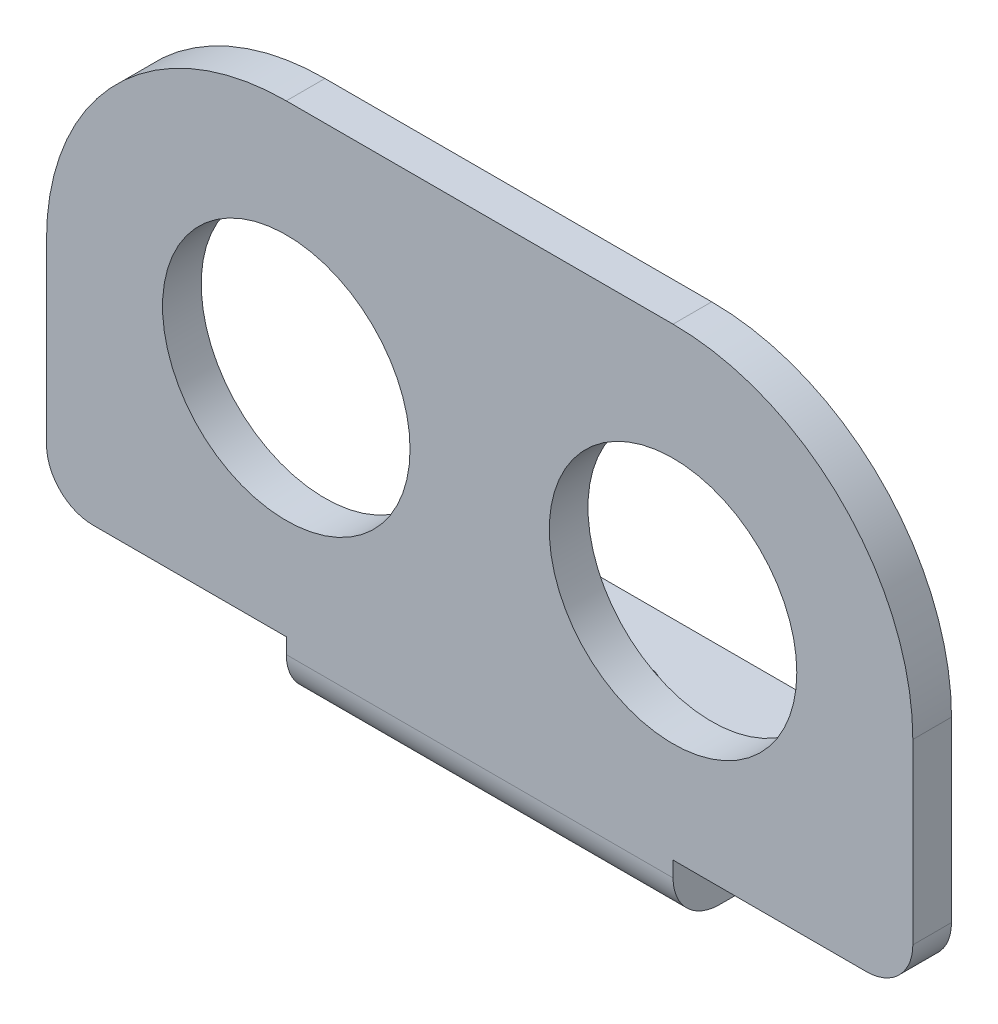
from build123d import *

# Parameters (mm, degrees)
SKETCH1_R           = 8
BOSS_EXTRUDE1_DEPTH = 2.5
FILLET1_R           = 3
SKETCH2_W           = 25
SKETCH2_H           = 3
BOSS_EXTRUDE2_DEPTH = 12
FILLET2_R           = 2.5
FILLET3_R           = 3
SKETCH3_R           = 1.5
CUT_EXTRUDE1_DEPTH  = 44.462627624


with BuildPart() as part:
    # Sketch1 → Boss-Extrude1 (new body)
    with BuildSketch(Plane.XY):
        with BuildLine():
            Line((-28, -15), (-28, -0.5))
            ThreePointArc((-28, -0.5), (-23.460155108, 10.460155108), (-12.5, 15))
            Line((-12.5, 15), (12.5, 15))
            ThreePointArc((12.5, 15), (23.460155108, 10.460155108), (28, -0.5))
            Line((28, -0.5), (28, -15))
            Line((28, -15), (12.5, -15))
            Line((12.5, -15), (12.5, -19))
            Line((12.5, -19), (-12.5, -19))
            Line((-12.5, -19), (-12.5, -15))
            Line((-12.5, -15), (-28, -15))
        make_face()
        with Locations((12.5, -0.5)):
            Circle(SKETCH1_R, mode=Mode.SUBTRACT)
        with Locations((-12.5, -0.5)):
            Circle(SKETCH1_R, mode=Mode.SUBTRACT)
    extrude(amount=BOSS_EXTRUDE1_DEPTH)

    # Fillet1
    fillet1_edges = [part.edges().sort_by_distance(p)[0] for p in [
        (-28, -15, 1.25),
        (28, -15, 1.25),
    ]]
    fillet(fillet1_edges, radius=FILLET1_R)

    # Sketch2 → Boss-Extrude2 (add)
    with BuildSketch(Plane(origin=(0, 0, 0), x_dir=(-1, 0, 0), z_dir=(0, 0, -1))):
        with Locations((0, -17.5)):
            Rectangle(SKETCH2_W, SKETCH2_H)
    extrude(amount=BOSS_EXTRUDE2_DEPTH)

    # Fillet2
    fillet2_edges = [part.edges().sort_by_distance(p)[0] for p in [
        (12.5, -17.5, -12),
        (-12.5, -17.5, -12),
    ]]
    fillet(fillet2_edges, radius=FILLET2_R)

    # Fillet3
    fillet3_edges = [part.edges().sort_by_distance(p)[0] for p in [
        (0, -19, 2.5),
    ]]
    fillet(fillet3_edges, radius=FILLET3_R)

    # Sketch3 → Cut-Extrude1 (cut, through all)
    with BuildSketch(Plane(origin=(0, -16, 0), x_dir=(1, 0, 0), z_dir=(0, 1, 0))):
        with Locations(Location((0, 7, 0), (0, 0, 270))):
            Circle(SKETCH3_R)
    extrude(amount=-CUT_EXTRUDE1_DEPTH, mode=Mode.SUBTRACT)


solid = part.part
